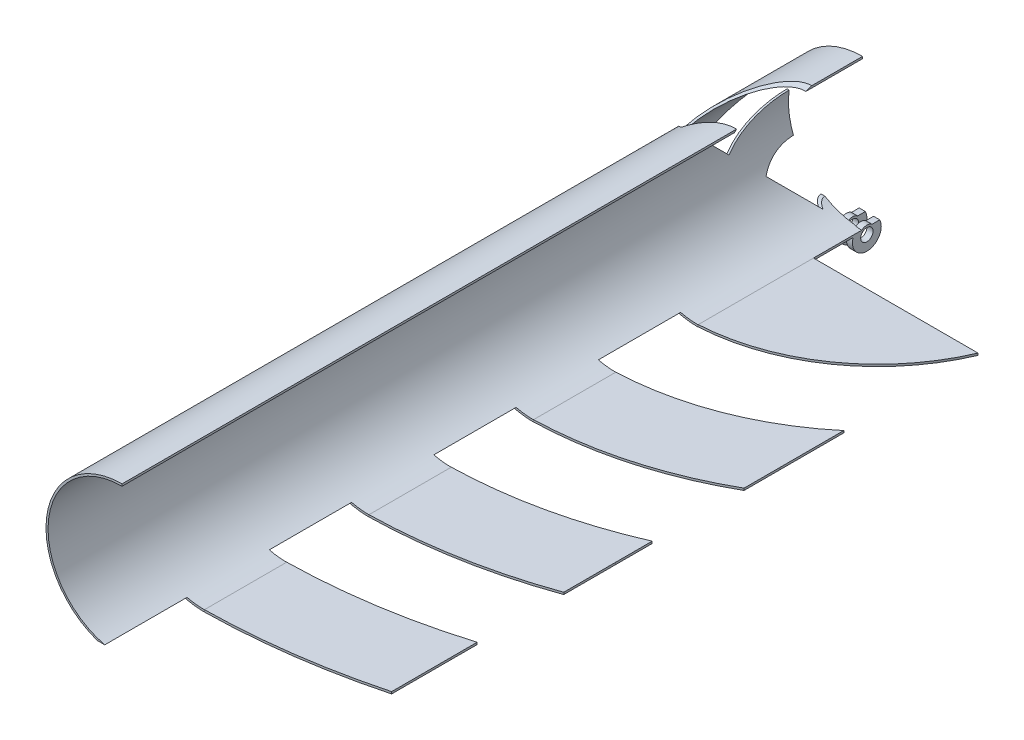
from build123d import *

# Parameters (mm, degrees)
SKETCH_1_R           = 18.5
SKETCH_1_R_2         = 18
EXTRUDE_1_DEPTH      = 180
CUT_EXTRUDE_1_DEPTH  = 30
SKETCH_5_R           = 1.5
EXTRUDE_2_DEPTH      = 5
SKETCH_8_R           = 1.5
CUT_EXTRUDE_2_DEPTH  = 2
SKETCH_9_R           = 1.5
CUT_EXTRUDE_3_DEPTH  = 2
SKETCH_12_W          = 21.543450216
SKETCH_12_H          = 50.101047014
CUT_EXTRUDE_4_DEPTH  = 201
SKETCH_13_W          = 20
SKETCH_13_H          = 0.5
EXTRUDE_3_DEPTH      = 40
SKETCH_14_W          = 20
SKETCH_14_H          = 1
CUT_EXTRUDE_5_DEPTH  = 40
EXTRUDE_4_DEPTH      = 0.5
CUT_EXTRUDE_25_DEPTH = 0.5
CUT_EXTRUDE_26_DEPTH = 0.5
CUT_EXTRUDE_27_DEPTH = 0.5


with BuildPart() as part:
    # 草图1 → 凸台-拉伸1 (new body)
    with BuildSketch(Plane.XY):
        with Locations(Location((0, 0, 0), (0, 0, 180))):
            Circle(SKETCH_1_R)
        with Locations(Location((0, 0, 0), (0, 0, 180))):
            Circle(SKETCH_1_R_2, mode=Mode.SUBTRACT)
    extrude(amount=EXTRUDE_1_DEPTH)

    # 草图4 → 切除-拉伸1 (cut, symmetric)
    with BuildSketch(Plane(origin=(0, 0, 0), x_dir=(0, 0, -1), z_dir=(1, 0, 0))):
        with BuildLine():
            Line((-2.121320344, -16.378679656), (-8.485281374, -10.014718626))
            ThreePointArc((-8.485281374, -10.014718626), (-4.592201188, -7.41344561), (0, -6.5))
            Line((0, -6.5), (0, -15.5))
            ThreePointArc((0, -15.5), (-1.148050297, -15.728361402), (-2.121320344, -16.378679656))
        make_face()
        with BuildLine():
            Line((-23.744748589, 23.215547635), (0, 23.215547635))
            Line((0, 23.215547635), (0, 20.5))
            ThreePointArc((0, 20.5), (-14.924653862, 17.531301768), (-27.577164466, 9.077164466))
            Line((-27.577164466, 9.077164466), (-33.941125497, 15.441125497))
            ThreePointArc((-33.941125497, 15.441125497), (-29.103701262, 19.670336295), (-23.744748589, 23.215547635))
        make_face()
        with BuildLine():
            Line((-14.849242405, -3.650757595), (-21.213203436, 2.713203436))
            ThreePointArc((-21.213203436, 2.713203436), (-11.480502971, 9.216385975), (0, 11.5))
            Line((0, 11.5), (0, 2.5))
            ThreePointArc((0, 2.5), (-8.03635208, 0.901470183), (-14.849242405, -3.650757595))
        make_face()
    extrude(amount=CUT_EXTRUDE_1_DEPTH, both=True, mode=Mode.SUBTRACT)

    # 草图5 → 凸台-拉伸2 (add, symmetric)
    with BuildSketch(Plane(origin=(0, 0, 0), x_dir=(0, 0, -1), z_dir=(1, 0, 0))):
        with BuildLine():
            Line((-0.190075543, -18), (-2.072124505, -18))
            ThreePointArc((-2.072124505, -18), (1.060660172, -23.060660172), (4.193444848, -18))
            Line((4.193444848, -18), (2.311395887, -18))
            ThreePointArc((2.311395887, -18), (1.060660172, -17.560660172), (-0.190075543, -18))
        make_face()
        with Locations((1.060660172, -19.560660172)):
            Circle(SKETCH_5_R, mode=Mode.SUBTRACT)
    extrude(amount=EXTRUDE_2_DEPTH, both=True)

    # 草图8 → 切除-拉伸2 (cut)
    with BuildSketch(Plane(origin=(3.5, 0, 0), x_dir=(0, 0, -1), z_dir=(1, 0, 0))):
        with BuildLine():
            Line((-0.190075543, -18), (-2.072124505, -18))
            ThreePointArc((-2.072124505, -18), (1.060660172, -23.060660172), (4.193444848, -18))
            Line((4.193444848, -18), (2.311395887, -18))
            ThreePointArc((2.311395887, -18), (1.060660172, -17.560660172), (-0.190075543, -18))
        make_face()
        with Locations((1.060660172, -19.560660172)):
            Circle(SKETCH_8_R, mode=Mode.SUBTRACT)
    extrude(amount=-CUT_EXTRUDE_2_DEPTH, mode=Mode.SUBTRACT)

    # 草图9 → 切除-拉伸3 (cut)
    with BuildSketch(Plane(origin=(-1.5, 0, 0), x_dir=(0, 0, -1), z_dir=(1, 0, 0))):
        with BuildLine():
            Line((-2.072124505, -18), (-0.190075543, -18))
            ThreePointArc((-0.190075543, -18), (1.060660172, -17.560660172), (2.311395887, -18))
            Line((2.311395887, -18), (4.193444848, -18))
            ThreePointArc((4.193444848, -18), (1.060660172, -23.060660172), (-2.072124505, -18))
        make_face()
        with Locations((1.060660172, -19.560660172)):
            Circle(SKETCH_9_R, mode=Mode.SUBTRACT)
    extrude(amount=-CUT_EXTRUDE_3_DEPTH, mode=Mode.SUBTRACT)

    # 草图12 → 切除-拉伸4 (cut, symmetric)
    with BuildSketch(Plane(origin=(0, 0, 0), x_dir=(-1, 0, 0), z_dir=(0, 0, -1))):
        with Locations((-10.771725108, -0.713406874)):
            Rectangle(SKETCH_12_W, SKETCH_12_H)
    extrude(amount=CUT_EXTRUDE_4_DEPTH, both=True, mode=Mode.SUBTRACT)

    # 草图13 → 凸台-拉伸3 (add)
    with BuildSketch(Plane(origin=(0, 0, 0), x_dir=(0, 0, -1), z_dir=(1, 0, 0))):
        with Locations((-110, -18.25)):
            Rectangle(SKETCH_13_W, SKETCH_13_H)
        with Locations((-70, -18.25)):
            Rectangle(SKETCH_13_W, SKETCH_13_H)
        with Locations((-150, -18.25)):
            Rectangle(SKETCH_13_W, SKETCH_13_H)
    extrude(amount=EXTRUDE_3_DEPTH)

    # 草图14 → 切除-拉伸5 (cut)
    with BuildSketch(Plane(origin=(0, 0, 0), x_dir=(0, 0, -1), z_dir=(1, 0, 0))):
        with Locations((-90, -18)):
            Rectangle(SKETCH_14_W, SKETCH_14_H)
        with Locations((-50, -18)):
            Rectangle(SKETCH_14_W, SKETCH_14_H)
        with Locations((-130, -18)):
            Rectangle(SKETCH_14_W, SKETCH_14_H)
        with Locations((-170, -18)):
            Rectangle(SKETCH_14_W, SKETCH_14_H)
    extrude(amount=-CUT_EXTRUDE_5_DEPTH, mode=Mode.SUBTRACT)

    # 草图16 → 凸台-拉伸4 (add)
    with BuildSketch(Plane.XZ.offset(18.5)):
        with BuildLine():
            Line((39.998675576, 44.557290849), (39.998953647, 68.795192772))
            ThreePointArc((39.998953647, 68.795192772), (20.682117379, 76.824270149), (0, 79.963739473))
            Line((0, 79.963739473), (0, 59.952777719))
            ThreePointArc((0, 59.952777719), (21.279727814, 55.581587428), (39.998675576, 44.557290849))
        make_face()
        with BuildLine():
            Line((0, 11.92), (0, 39.932309719))
            ThreePointArc((0, 39.932309719), (24.002531018, 31.642513786), (39.998301143, 11.92))
            Line((39.998301143, 11.92), (0, 11.92))
        make_face()
        with BuildLine():
            Line((0, 159.981196289), (0, 139.978623608))
            ThreePointArc((0, 139.978623608), (20.218739097, 138.224024642), (39.999698116, 133.686438442))
            Line((39.999698116, 133.686438442), (39.999936605, 154.474190176))
            ThreePointArc((39.999936605, 154.474190176), (20.167826378, 158.446924196), (0, 159.981196289))
        make_face()
        with BuildLine():
            Line((39.999209833, 91.125521645), (39.999456529, 112.628600071))
            ThreePointArc((39.999456529, 112.628600071), (20.297610274, 117.92376471), (0, 119.975235288))
            Line((0, 119.975235288), (0, 99.97057031))
            ThreePointArc((0, 99.97057031), (20.430131767, 97.494980868), (39.999209833, 91.125521645))
        make_face()
    extrude(amount=-EXTRUDE_4_DEPTH)

    # 草图20 → 切除-拉伸25 (cut)
    with BuildSketch(Plane.XZ.offset(18.5)):
        with BuildLine():
            Line((40, 80), (40, 68.794599806))
            ThreePointArc((40, 68.794599806), (20.682696569, 76.824108425), (0, 79.963739473))
            Line((0, 79.963739473), (0, 80))
            Line((0, 80), (40, 80))
        make_face()
    extrude(amount=-CUT_EXTRUDE_25_DEPTH, mode=Mode.SUBTRACT)

    # 草图22 → 切除-拉伸26 (cut)
    with BuildSketch(Plane.XZ.offset(18.5)):
        with BuildLine():
            Line((40, 120), (40, 112.628405695))
            ThreePointArc((40, 112.628405695), (20.297894119, 117.923712576), (0, 119.975235288))
            Line((0, 119.975235288), (0, 120))
            Line((0, 120), (40, 120))
        make_face()
    extrude(amount=-CUT_EXTRUDE_26_DEPTH, mode=Mode.SUBTRACT)

    # 草图23 → 切除-拉伸27 (cut)
    with BuildSketch(Plane.XZ.offset(18.5)):
        with BuildLine():
            Line((40, 160), (40, 154.474173407))
            ThreePointArc((40, 154.474173407), (20.167858859, 158.446919724), (0, 159.981196289))
            Line((0, 159.981196289), (0, 160))
            Line((0, 160), (40, 160))
        make_face()
    extrude(amount=-CUT_EXTRUDE_27_DEPTH, mode=Mode.SUBTRACT)


solid = part.part
